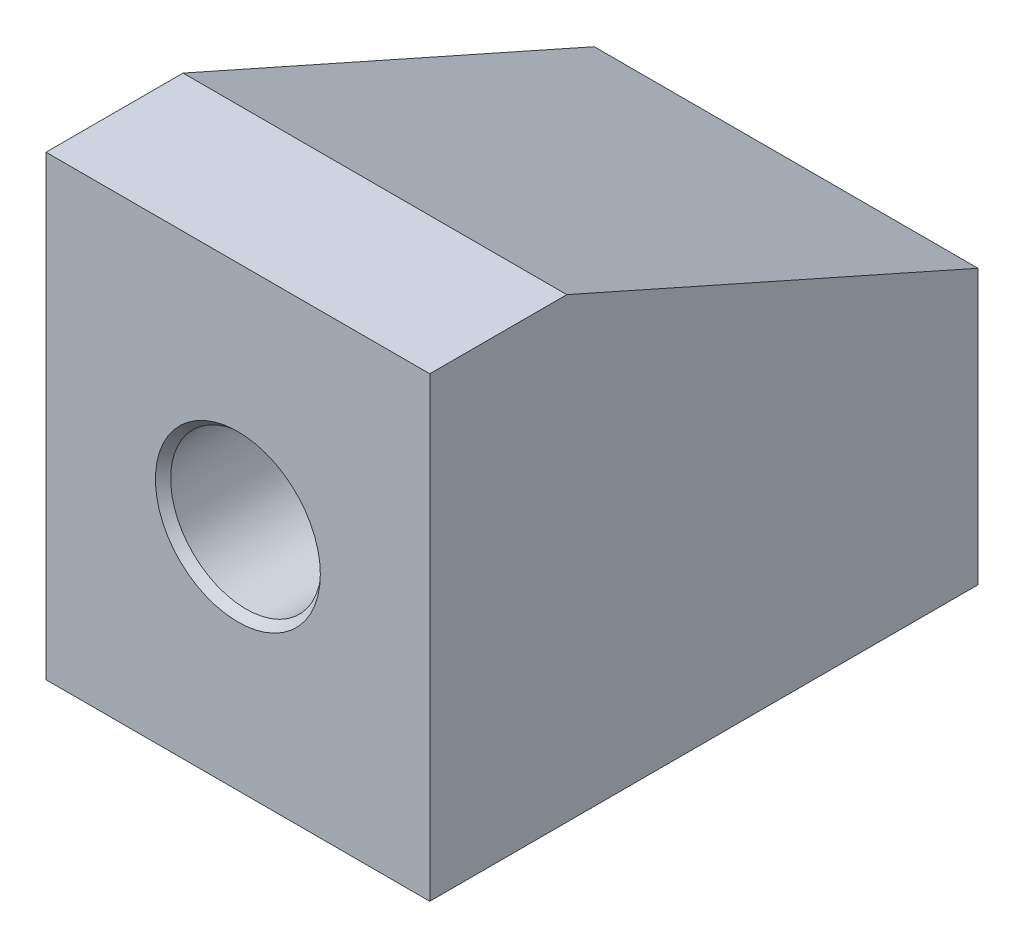
from build123d import *

# Parameters (mm, degrees)
ESTRUSIONE_ESTRUSIONE1_DEPTH         = 42
FORO_FILETTATO_M18X1_5_1_D           = 16.5
FORO_FILETTATO_M18X1_5_1_DEPTH       = 38.542899893
FORO_FILETTATO_M18X1_5_1_CSINK_D     = 18.05
FORO_FILETTATO_M18X1_5_1_CSINK_ANGLE = 82
FORO_FILETTATO_M18X1_5_1_TIP         = 4.957100107


with BuildPart() as part:
    # Schizzo1 → Estrusione-Estrusione1 (new body)
    with BuildSketch(Plane(origin=(0, 0, 0), x_dir=(0, 0, -1), z_dir=(1, 0, 0))):
        Polygon((-30, 50), (-30, 0), (30, 0), (30, 30), (-15, 50), align=None)
    extrude(amount=ESTRUSIONE_ESTRUSIONE1_DEPTH)

    # Foro filettato M18x1.5-1
    with Locations(Plane.XY.offset(30)):
        with Locations((21, 25)):
            CounterSinkHole(FORO_FILETTATO_M18X1_5_1_D / 2, FORO_FILETTATO_M18X1_5_1_CSINK_D / 2, depth=FORO_FILETTATO_M18X1_5_1_DEPTH, counter_sink_angle=FORO_FILETTATO_M18X1_5_1_CSINK_ANGLE)
            with Locations((0, 0, -(FORO_FILETTATO_M18X1_5_1_DEPTH + FORO_FILETTATO_M18X1_5_1_TIP / 2))):  # 118° drill point
                Cone(0, FORO_FILETTATO_M18X1_5_1_D / 2, FORO_FILETTATO_M18X1_5_1_TIP, mode=Mode.SUBTRACT)


solid = part.part
